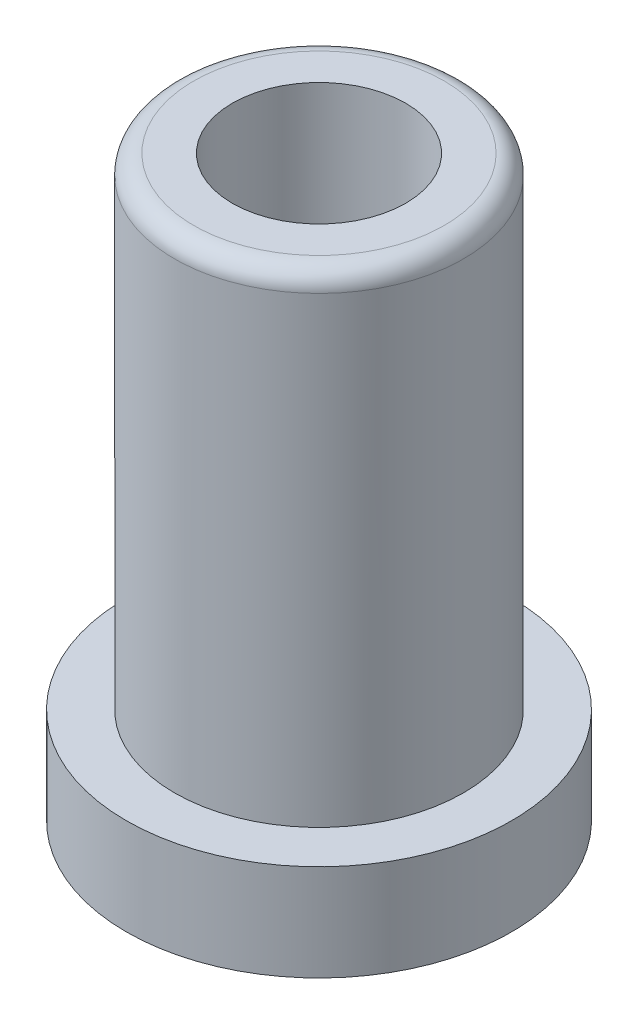
from build123d import *

# Parameters (mm, degrees)
SKIZZE1_R                       = 1
AUFSATZ_LINEAR_AUSTRAGEN1_DEPTH = 0.5
SKIZZE2_R                       = 0.75
AUFSATZ_LINEAR_AUSTRAGEN2_DEPTH = 3
VERRUNDUNG1_R                   = 0.1
SKIZZE3_R                       = 0.45
SCHNITT_LINEAR_AUSTRAGEN1_DEPTH = 2.5


with BuildPart() as part:
    # Skizze1 → Aufsatz-Linear austragen1 (new body)
    with BuildSketch(Plane(origin=(0, 0, 0), x_dir=(1, 0, 0), z_dir=(0, 1, 0))):
        with Locations(Location((0, 0, 0), (0, 0, 270))):
            Circle(SKIZZE1_R)
    extrude(amount=AUFSATZ_LINEAR_AUSTRAGEN1_DEPTH)

    # Skizze2 → Aufsatz-Linear austragen2 (add)
    with BuildSketch(Plane.XZ):
        with Locations(Location((0, 0, 0), (0, 0, 270))):
            Circle(SKIZZE2_R)
    extrude(amount=-AUFSATZ_LINEAR_AUSTRAGEN2_DEPTH)

    # Verrundung1
    verrundung1_edges = [part.edges().sort_by_distance(p)[0] for p in [
        (0, 3, 0.75),
    ]]
    fillet(verrundung1_edges, radius=VERRUNDUNG1_R)

    # Skizze3 → Schnitt-Linear austragen1 (cut)
    with BuildSketch(Plane(origin=(0, 3, 0), x_dir=(1, 0, 0), z_dir=(0, 1, 0))):
        with Locations(Location((0, 0, 0), (0, 0, 270))):
            Circle(SKIZZE3_R)
    extrude(amount=-SCHNITT_LINEAR_AUSTRAGEN1_DEPTH, mode=Mode.SUBTRACT)


solid = part.part
